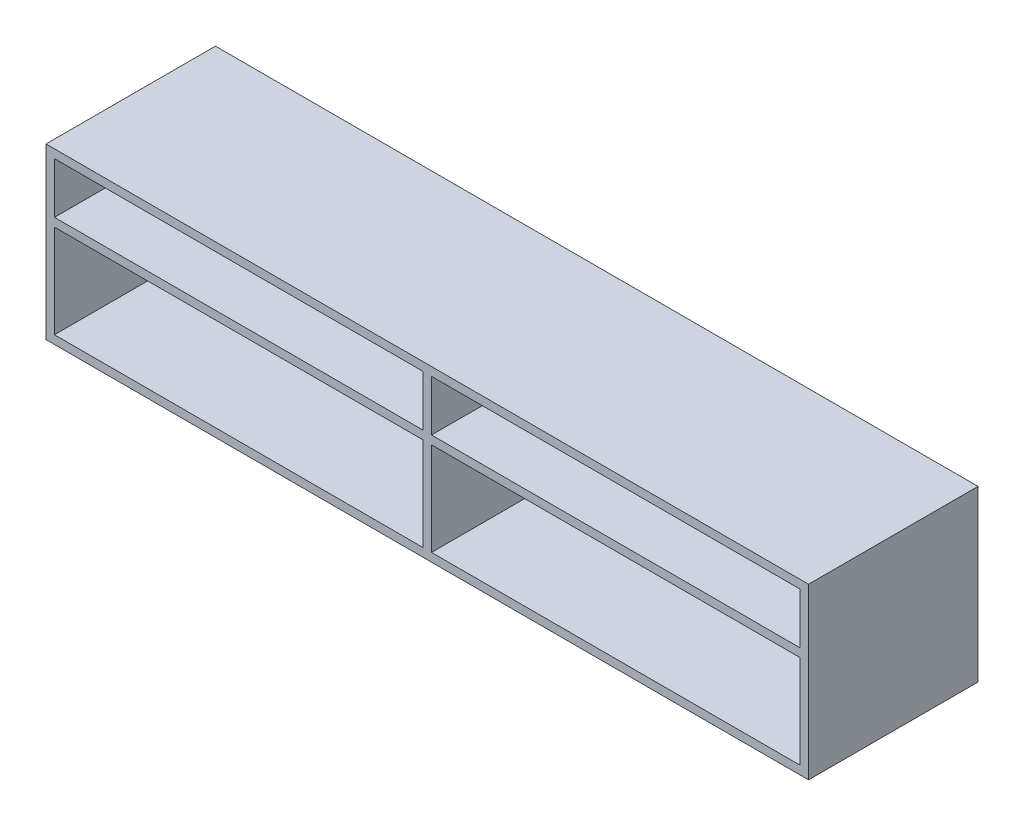
from build123d import *

# Parameters (mm, degrees)
SKETCH1_W           = 1800
SKETCH1_H           = 400
SKETCH1_W_2         = 870
SKETCH1_H_2         = 120
SKETCH1_H_3         = 220
BOSS_EXTRUDE1_DEPTH = 400


with BuildPart() as part:
    # Sketch1 → Boss-Extrude1 (new body)
    with BuildSketch(Plane.XY):
        with Locations((900, 200)):
            Rectangle(SKETCH1_W, SKETCH1_H)
        with Locations((455, 320)):
            Rectangle(SKETCH1_W_2, SKETCH1_H_2, mode=Mode.SUBTRACT)
        with Locations((455, 130)):
            Rectangle(SKETCH1_W_2, SKETCH1_H_3, mode=Mode.SUBTRACT)
        with Locations((1345, 130)):
            Rectangle(SKETCH1_W_2, SKETCH1_H_3, mode=Mode.SUBTRACT)
        with Locations((1345, 320)):
            Rectangle(SKETCH1_W_2, SKETCH1_H_2, mode=Mode.SUBTRACT)
    extrude(amount=BOSS_EXTRUDE1_DEPTH)


solid = part.part
